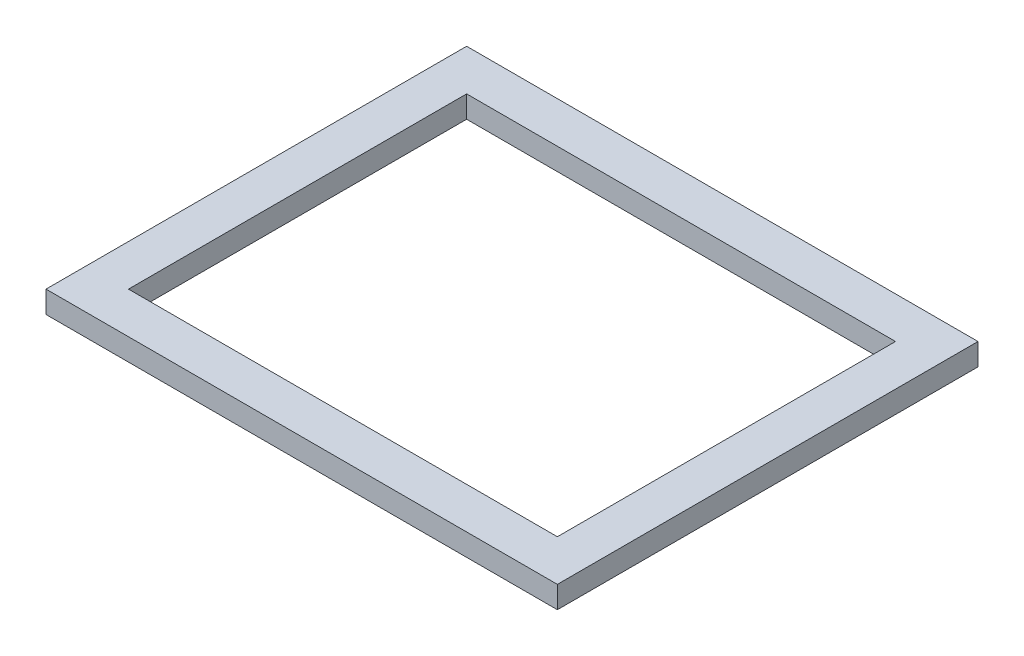
from build123d import *

# Parameters (mm, degrees)
SKETCH1_W           = 18.6
SKETCH1_H           = 15.3
SKETCH1_W_2         = 15.6
SKETCH1_H_2         = 12.3
EXTRUDE_THIN1_DEPTH = 0.8


with BuildPart() as part:
    # Sketch1 → Extrude-Thin1 (new body)
    with BuildSketch(Plane(origin=(0, 0, 0), x_dir=(1, 0, 0), z_dir=(0, 1, 0))):
        Rectangle(SKETCH1_W, SKETCH1_H)
        Rectangle(SKETCH1_W_2, SKETCH1_H_2, mode=Mode.SUBTRACT)
    extrude(amount=EXTRUDE_THIN1_DEPTH)


solid = part.part
